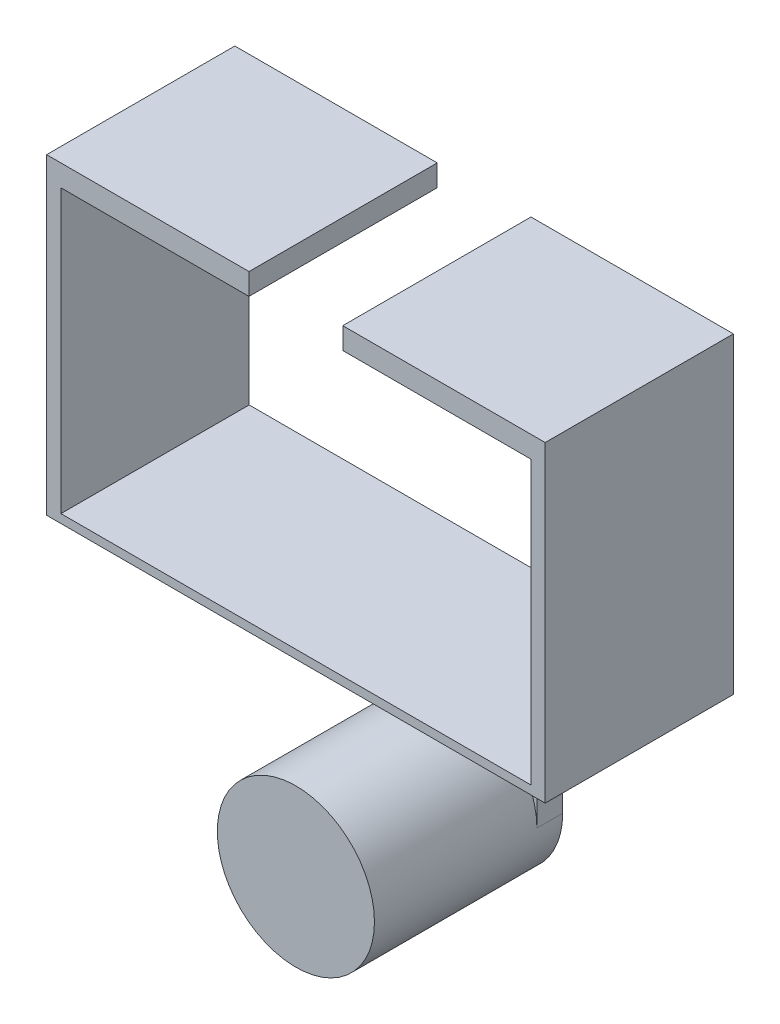
from build123d import *

# Parameters (mm, degrees)
SKETCH1_R             = 10.603707514
BOSS_EXTRUDE1_DEPTH   = 25.4
BOSS_EXTRUDE1_2_DEPTH = 25.4
BOSS_EXTRUDE3_DEPTH   = 3.47673544


with BuildPart() as part:
    # Sketch1 → Boss-Extrude1 (new body)
    with BuildSketch(Plane.XY):
        Circle(SKETCH1_R)
    extrude(amount=BOSS_EXTRUDE1_DEPTH)



with BuildPart() as body_2:
    # Sketch1 → Boss-Extrude1 2 (new body)
    with BuildSketch(Plane.XY):
        Polygon((-33.640809115, 67.542598602), (-33.640809115, 25.4), (33.640809115, 25.4), (33.640809115, 67.542598602), (6.3246, 67.542598602), (6.3246, 64.637417314), (31.70428, 64.637417314), (31.70428, 26.562817314), (-31.70428, 26.562817314), (-31.70428, 64.637417314), (-6.3246, 64.637417314), (-6.3246, 67.542598602), align=None)
    extrude(amount=BOSS_EXTRUDE1_2_DEPTH)


with BuildPart() as part_1:
    add(part.part)

    add(body_2.part)  # Boss-Extrude3 merges body 2
    # Sketch3 → Boss-Extrude3 (add)
    with BuildSketch(Plane(origin=(0, 0, 0), x_dir=(-1, 0, 0), z_dir=(0, 0, -1))):
        with BuildLine():
            Line((-10.603707514, 0), (-10.603707514, 25.4))
            Line((-10.603707514, 25.4), (10.603707514, 25.4))
            Line((10.603707514, 25.4), (10.603707514, 0))
            ThreePointArc((10.603707514, 0), (0, -10.603707514), (-10.603707514, 0))
        make_face()
    extrude(amount=-BOSS_EXTRUDE3_DEPTH)


solid = part_1.part
